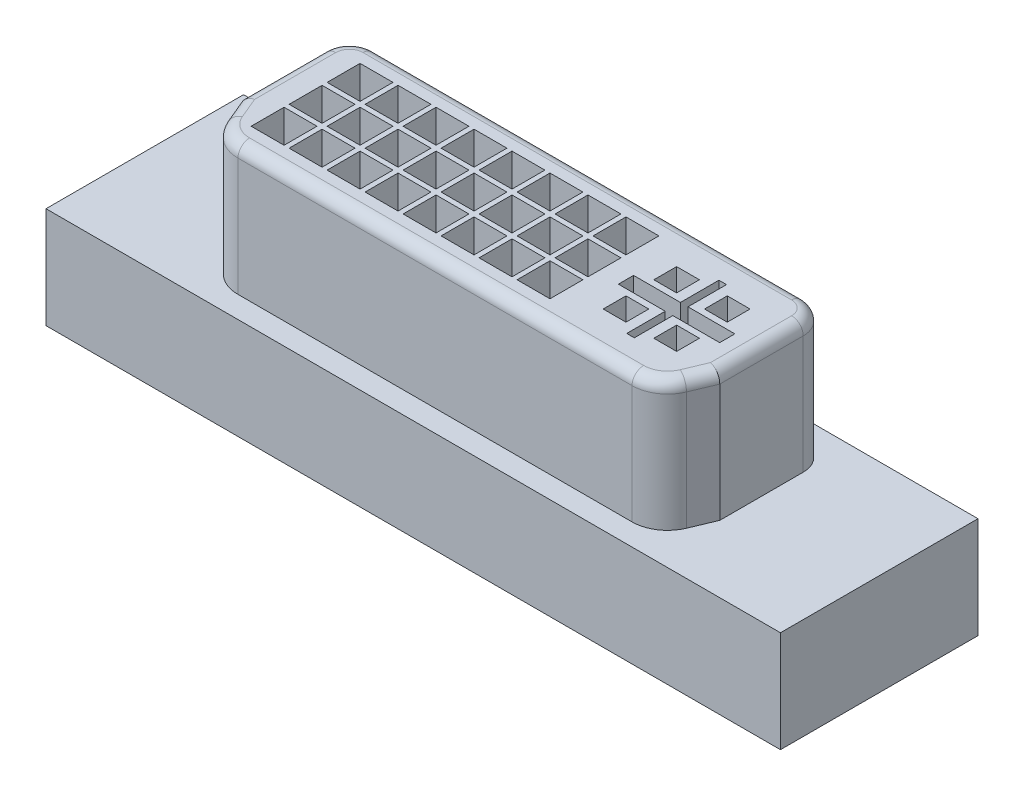
from build123d import *

# Parameters (mm, degrees)
SKETCH1_W            = 36.83
SKETCH1_H            = 9.906
BOSS_EXTRUDE1_DEPTH  = 5.08
BOSS_EXTRUDE2_DEPTH  = 6.5024
FILLET1_R            = 0.5842
CUT_EXTRUDE2_DEPTH   = 11.5316
BOSS_EXTRUDE3_DEPTH  = 11.5316
CUT_EXTRUDE1_START   = 6.5024
SKETCH2_3_W          = 1.651
SKETCH2_3_H          = 1.651
CUT_EXTRUDE1_DEPTH   = 11.5316
LPATTERN1_COUNT      = 8
LPATTERN1_PITCH      = 1.905
LPATTERN1_COUNT_DIR2 = 3
LPATTERN1_PITCH_DIR2 = 1.905
CUT_EXTRUDE3_START   = 6.5024
SKETCH2_4_W          = 1.143
SKETCH2_4_H          = 1.143
SKETCH2_4_W_2        = 5.08
SKETCH2_4_H_2        = 0.762
SKETCH2_4_W_3        = 0.381
SKETCH2_4_H_3        = 4.6228
CUT_EXTRUDE3_DEPTH   = 11.5316


with BuildPart() as part:
    # Sketch1 → Boss-Extrude1 (new body)
    with BuildSketch(Plane(origin=(0, 0, 0), x_dir=(1, 0, 0), z_dir=(0, 1, 0))):
        Rectangle(SKETCH1_W, SKETCH1_H)
    extrude(amount=-BOSS_EXTRUDE1_DEPTH)

    # Sketch2 → Boss-Extrude2 (add)
    with BuildSketch(Plane(origin=(0, 0, 0), x_dir=(1, 0, 0), z_dir=(0, 1, 0))):
        with BuildLine():
            Line((-10.7442, 3.8608), (10.7442, 3.8608))
            ThreePointArc((10.7442, 3.8608), (11.642225612, 3.488825612), (12.0142, 2.5908))
            Line((12.0142, 2.5908), (12.0142, -1.594793783))
            Line((12.0142, -1.594793783), (11.519792912, -2.77151663))
            ThreePointArc((11.519792912, -2.77151663), (10.864659407, -3.563648096), (9.8806, -3.8608))
            Line((9.8806, -3.8608), (-9.8806, -3.8608))
            ThreePointArc((-9.8806, -3.8608), (-10.864659407, -3.563648096), (-11.519792912, -2.77151663))
            Line((-11.519792912, -2.77151663), (-12.0142, -1.594793783))
            Line((-12.0142, -1.594793783), (-12.0142, 2.5908))
            ThreePointArc((-12.0142, 2.5908), (-11.642225612, 3.488825612), (-10.7442, 3.8608))
        make_face()
    extrude(amount=BOSS_EXTRUDE2_DEPTH)

    # Fillet1
    fillet1_edges = [part.edges().sort_by_distance(p)[0] for p in [
        (10.864659407, 6.5024, 3.563648096),
        (12.0142, 6.5024, -0.498003109),
        (11.642225612, 6.5024, -3.488825612),
        (0, 6.5024, -3.8608),
        (-11.766996456, 6.5024, 2.183155206),
        (-10.864659407, 6.5024, 3.563648096),
        (0, 6.5024, 3.8608),
        (11.766996456, 6.5024, 2.183155206),
        (-11.642225612, 6.5024, -3.488825612),
        (-12.0142, 6.5024, -0.498003109),
    ]]
    fillet(fillet1_edges, radius=FILLET1_R)

    # Sketch3 → Cut-Extrude2 (cut)
    with BuildSketch(Plane(origin=(0, 6.5024, 0), x_dir=(1, 0, 0), z_dir=(0, 1, 0))):
        with BuildLine():
            Line((-11.43, 2.5908), (-11.43, -1.477051453))
            Line((-11.43, -1.477051453), (-10.981200955, -2.545224023))
            ThreePointArc((-10.981200955, -2.545224023), (-10.541325602, -3.077083722), (-9.8806, -3.2766))
            Line((-9.8806, -3.2766), (9.8806, -3.2766))
            ThreePointArc((9.8806, -3.2766), (10.541325602, -3.077083722), (10.981200955, -2.545224023))
            Line((10.981200955, -2.545224023), (11.43, -1.477051453))
            Line((11.43, -1.477051453), (11.43, 2.5908))
            ThreePointArc((11.43, 2.5908), (11.229133831, 3.075733831), (10.7442, 3.2766))
            Line((10.7442, 3.2766), (-10.7442, 3.2766))
            ThreePointArc((-10.7442, 3.2766), (-11.229133831, 3.075733831), (-11.43, 2.5908))
        make_face()
    extrude(amount=-CUT_EXTRUDE2_DEPTH, mode=Mode.SUBTRACT)


with BuildPart() as body_2:
    # Sketch3<2> → Boss-Extrude3 (new body)
    with BuildSketch(Plane(origin=(0, 6.5024, 0), x_dir=(1, 0, 0), z_dir=(0, 1, 0))):
        with BuildLine():
            Line((-11.43, 2.5908), (-11.43, -1.477051453))
            Line((-11.43, -1.477051453), (-10.981200955, -2.545224023))
            ThreePointArc((-10.981200955, -2.545224023), (-10.541325602, -3.077083722), (-9.8806, -3.2766))
            Line((-9.8806, -3.2766), (9.8806, -3.2766))
            ThreePointArc((9.8806, -3.2766), (10.541325602, -3.077083722), (10.981200955, -2.545224023))
            Line((10.981200955, -2.545224023), (11.43, -1.477051453))
            Line((11.43, -1.477051453), (11.43, 2.5908))
            ThreePointArc((11.43, 2.5908), (11.229133831, 3.075733831), (10.7442, 3.2766))
            Line((10.7442, 3.2766), (-10.7442, 3.2766))
            ThreePointArc((-10.7442, 3.2766), (-11.229133831, 3.075733831), (-11.43, 2.5908))
        make_face()
    extrude(amount=-BOSS_EXTRUDE3_DEPTH)

    # Sketch2<3> → Cut-Extrude1 (cut)
    with BuildSketch(Plane(origin=(0, 0, 0), x_dir=(1, 0, 0), z_dir=(0, 1, 0)).offset(CUT_EXTRUDE1_START)):
        with Locations((-9.525, 1.905)):
            Rectangle(SKETCH2_3_W, SKETCH2_3_H)
    cut_extrude1 = extrude(amount=-CUT_EXTRUDE1_DEPTH, mode=Mode.SUBTRACT)

    # LPattern1: Cut-Extrude1 8 × 3
    with Locations(*[(i * LPATTERN1_PITCH, 0, j * LPATTERN1_PITCH_DIR2) for i in range(LPATTERN1_COUNT) for j in range(LPATTERN1_COUNT_DIR2) if (i, j) != (0, 0)]):
        add(cut_extrude1, mode=Mode.SUBTRACT)

    # Sketch2<4> → Cut-Extrude3 (cut)
    with BuildSketch(Plane(origin=(0, 0, 0), x_dir=(1, 0, 0), z_dir=(0, 1, 0)).offset(CUT_EXTRUDE3_START)):
        with Locations((9.525, -1.27)):
            Rectangle(SKETCH2_4_W, SKETCH2_4_H)
        with Locations((9.525, 1.27)):
            Rectangle(SKETCH2_4_W, SKETCH2_4_H)
        with Locations((6.985, -1.27)):
            Rectangle(SKETCH2_4_W, SKETCH2_4_H)
        with Locations((6.985, 1.27)):
            Rectangle(SKETCH2_4_W, SKETCH2_4_H)
        with Locations((8.255, 0)):
            Rectangle(SKETCH2_4_W_2, SKETCH2_4_H_2)
        with Locations((8.255, 0)):
            Rectangle(SKETCH2_4_W_3, SKETCH2_4_H_3)
    extrude(amount=-CUT_EXTRUDE3_DEPTH, mode=Mode.SUBTRACT)


solid = Compound([part.part, body_2.part])
